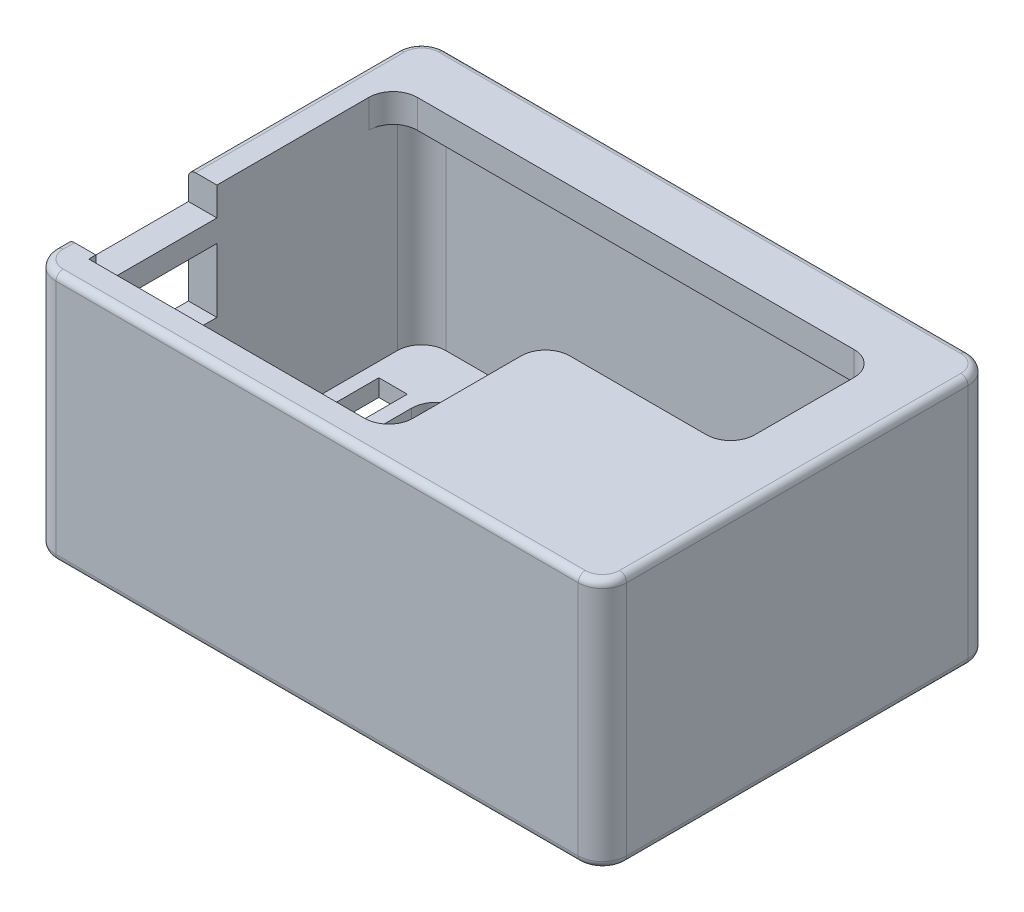
from build123d import *

# Parameters (mm, degrees)
BOSS_EXTRUDE2_DEPTH = 14.4
SKETCH3_W           = 40.068
SKETCH3_H           = 27.368
SKETCH3_W_2         = 28.068
SKETCH3_H_2         = 17.368
BOSS_EXTRUDE3_DEPTH = 1.2
BOSS_EXTRUDE4_START = 14.4
SKETCH1_4_W         = 40.068
SKETCH1_4_H         = 27.368
BOSS_EXTRUDE4_DEPTH = 2
FILLET1_R           = 1.7
FILLET2_R           = 1.7
SKETCH4_W           = 8.5
SKETCH4_H           = 4.5
CUT_EXTRUDE1_DEPTH  = 2
SKETCH5_W           = 2
SKETCH5_H           = 10
CUT_EXTRUDE2_DEPTH  = 1.2
CUT_EXTRUDE3_DEPTH  = 2
FILLET4_R           = 1.7
SKETCH7_W           = 8.5
SKETCH7_H           = 2
CUT_EXTRUDE4_DEPTH  = 2
FILLET5_R           = 0.5


with BuildPart() as part:
    # Sketch1 → Boss-Extrude2 (new body)
    with BuildSketch(Plane(origin=(0, 0, 0), x_dir=(1, 0, 0), z_dir=(0, 1, 0))):
        Polygon((-20.034, 0), (-18.034, 0), (-18.034, 11.684), (0, 11.684), (0, 13.684), (-20.034, 13.684), align=None)
        Polygon((18.034, 11.684), (18.034, 0), (20.034, 0), (20.034, 13.684), (0, 13.684), (0, 11.684), align=None)
        Polygon((18.034, 0), (18.034, -11.684), (0, -11.684), (0, -13.684), (20.034, -13.684), (20.034, 0), align=None)
        Polygon((0, -13.684), (0, -11.684), (-18.034, -11.684), (-18.034, 0), (-20.034, 0), (-20.034, -13.684), align=None)
    extrude(amount=BOSS_EXTRUDE2_DEPTH)

    # Sketch3 → Boss-Extrude3 (add)
    with BuildSketch(Plane.XZ):
        Rectangle(SKETCH3_W, SKETCH3_H)
        Rectangle(SKETCH3_W_2, SKETCH3_H_2, mode=Mode.SUBTRACT)
    extrude(amount=BOSS_EXTRUDE3_DEPTH)

    # Sketch1<4> → Boss-Extrude4 (add)
    with BuildSketch(Plane(origin=(0, 0, 0), x_dir=(1, 0, 0), z_dir=(0, 1, 0)).offset(BOSS_EXTRUDE4_START)):
        Rectangle(SKETCH1_4_W, SKETCH1_4_H)
    extrude(amount=BOSS_EXTRUDE4_DEPTH)

    # Fillet1
    fillet1_edges = [part.edges().sort_by_distance(p)[0] for p in [
        (18.034, 7.2, -11.684),
        (-18.034, 7.2, -11.684),
        (18.034, 7.2, 11.684),
        (-20.034, 7.6, 13.684),
        (-20.034, 7.6, -13.684),
        (20.034, 7.6, -13.684),
        (20.034, 7.6, 13.684),
    ]]
    fillet(fillet1_edges, radius=FILLET1_R)

    # Fillet2
    fillet2_edges = [part.edges().sort_by_distance(p)[0] for p in [
        (14.034, -0.6, -8.684),
        (-14.034, -0.6, -8.684),
        (-14.034, -0.6, 8.684),
        (14.034, -0.6, 8.684),
    ]]
    fillet(fillet2_edges, radius=FILLET2_R)

    # Sketch4 → Cut-Extrude1 (cut)
    with BuildSketch(Plane.ZY.offset(20.034)):
        with Locations((6.934, 10.6)):
            Rectangle(SKETCH4_W, SKETCH4_H)
    extrude(amount=-CUT_EXTRUDE1_DEPTH, mode=Mode.SUBTRACT)

    # Sketch5 → Cut-Extrude2 (cut)
    with BuildSketch(Plane(origin=(0, 0, 0), x_dir=(-1, 0, 0), z_dir=(0, -1, 0))):
        with Locations((16.034, 2.684)):
            Rectangle(SKETCH5_W, SKETCH5_H)
    extrude(amount=CUT_EXTRUDE2_DEPTH, mode=Mode.SUBTRACT)

    # Sketch6 → Cut-Extrude3 (cut)
    with BuildSketch(Plane(origin=(0, 16.4, 0), x_dir=(1, 0, 0), z_dir=(0, 1, 0))):
        Polygon((-18.034, -11.684), (3.034, -11.684), (3.034, -0.684), (16.034, -0.684), (16.034, 9.684), (-18.034, 9.684), align=None)
    extrude(amount=-CUT_EXTRUDE3_DEPTH, mode=Mode.SUBTRACT)

    # Fillet4
    fillet4_edges = [part.edges().sort_by_distance(p)[0] for p in [
        (-18.034, 15.4, -9.684),
        (16.034, 15.4, -9.684),
        (16.034, 15.4, 0.684),
        (3.034, 15.4, 0.684),
        (3.034, 15.4, 11.684),
    ]]
    fillet(fillet4_edges, radius=FILLET4_R)

    # Sketch7 → Cut-Extrude4 (cut)
    with BuildSketch(Plane.ZY.offset(20.034)):
        with Locations((6.934, 15.4)):
            Rectangle(SKETCH7_W, SKETCH7_H)
    extrude(amount=-CUT_EXTRUDE4_DEPTH, mode=Mode.SUBTRACT)

    # Fillet5
    fillet5_edges = [part.edges().sort_by_distance(p)[0] for p in [
        (-20.034, 16.4, 11.584),
        (0, -1.2, 13.684),
        (0, 16.4, 13.684),
        (20.034, -1.2, 0),
        (-20.034, -1.2, 0),
        (0, -1.2, -13.684),
        (-19.536081528, -1.2, -13.186081528),
        (19.536081528, -1.2, -13.186081528),
        (19.536081528, -1.2, 13.186081528),
        (-19.536081528, -1.2, 13.186081528),
        (-20.034, 16.4, -4.65),
        (20.034, 16.4, 0),
        (0, 16.4, -13.684),
        (-19.536081528, 16.4, -13.186081528),
        (19.536081528, 16.4, -13.186081528),
        (19.536081528, 16.4, 13.186081528),
        (-19.536081528, 16.4, 13.186081528),
    ]]
    fillet(fillet5_edges, radius=FILLET5_R)


solid = part.part
